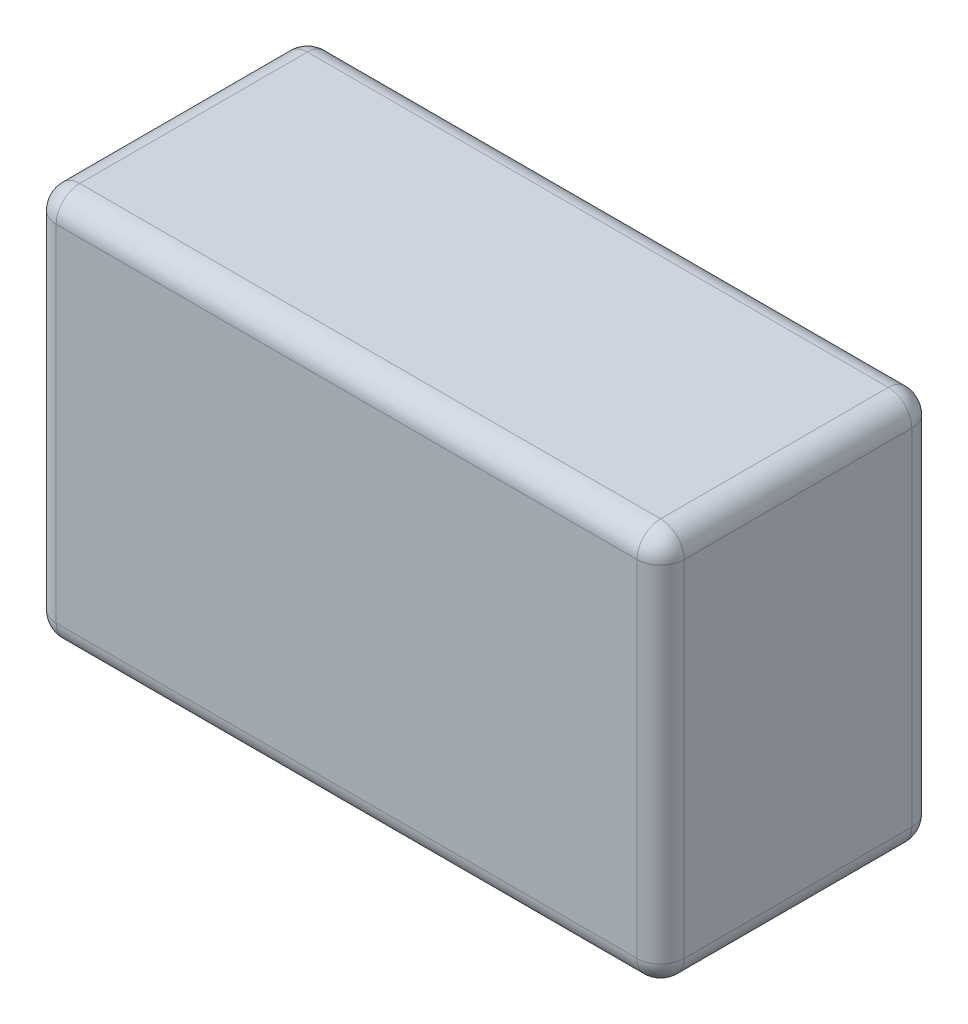
from build123d import *

# Parameters (mm, degrees)
SKETCH1_W           = 80
SKETCH1_H           = 50
BOSS_EXTRUDE1_DEPTH = 35
FILLET1_R           = 3


with BuildPart() as part:
    # Sketch1 → Boss-Extrude1 (new body)
    with BuildSketch(Plane.XY):
        with Locations((0.977289629, 40.878922039)):
            Rectangle(SKETCH1_W, SKETCH1_H)
    extrude(amount=BOSS_EXTRUDE1_DEPTH)

    # Fillet1
    fillet1_edges = [part.edges().sort_by_distance(p)[0] for p in [
        (40.977289629, 40.878922039, 35),
        (0.977289629, 65.878922039, 35),
        (-39.022710371, 40.878922039, 35),
        (0.977289629, 65.878922039, 0),
        (40.977289629, 40.878922039, 0),
        (0.977289629, 15.878922039, 0),
        (-39.022710371, 40.878922039, 0),
        (0.977289629, 15.878922039, 35),
        (-39.022710371, 65.878922039, 17.5),
        (40.977289629, 65.878922039, 17.5),
        (40.977289629, 15.878922039, 17.5),
        (-39.022710371, 15.878922039, 17.5),
    ]]
    fillet(fillet1_edges, radius=FILLET1_R)


solid = part.part
